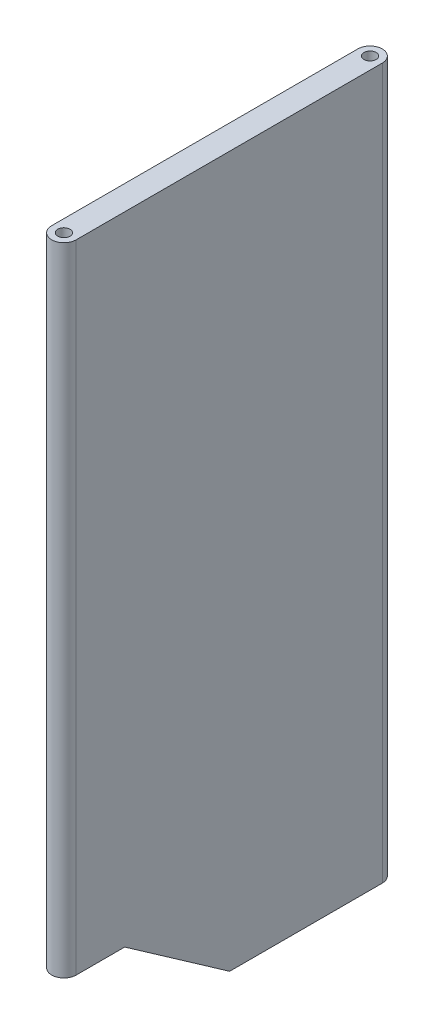
from build123d import *

# Parameters (mm, degrees)
EXTRUDE_1_DEPTH = 2
SKETCH_2_R      = 0.5
EXTRUDE_2_DEPTH = 58
SKETCH_3_R      = 0.5
EXTRUDE_3_DEPTH = 52


with BuildPart() as part:
    # Эскиз1 → Бобышка-Вытянуть1 (new body)
    with BuildSketch(Plane(origin=(0, 0, 0), x_dir=(0, 0, -1), z_dir=(1, 0, 0))):
        Polygon((-23, 6), (-20.034972426, 6), (-11.466084386, 0), (0, 0), (0, 58), (-23, 58), align=None)
    extrude(amount=EXTRUDE_1_DEPTH)

    # Эскиз2 → Бобышка-Вытянуть2 (add)
    with BuildSketch(Plane(origin=(0, 0, 0), x_dir=(1, 0, 0), z_dir=(0, 1, 0))):
        with BuildLine():
            Line((0, 1), (0, 0))
            Line((0, 0), (2, 0))
            Line((2, 0), (2, 1))
            ThreePointArc((2, 1), (1, 2), (0, 1))
        make_face()
        with Locations(Location((1, 1, 0), (0, 0, 270))):
            Circle(SKETCH_2_R, mode=Mode.SUBTRACT)
    extrude(amount=EXTRUDE_2_DEPTH)

    # Эскиз3 → Бобышка-Вытянуть3 (add)
    with BuildSketch(Plane.XZ.offset(-6)):
        with BuildLine():
            Line((0, 23), (0, 24))
            ThreePointArc((0, 24), (1, 25), (2, 24))
            Line((2, 24), (2, 23))
            Line((2, 23), (0, 23))
        make_face()
        with Locations(Location((1, 24, 0), (0, 0, 270))):
            Circle(SKETCH_3_R, mode=Mode.SUBTRACT)
    extrude(amount=-EXTRUDE_3_DEPTH)


solid = part.part
